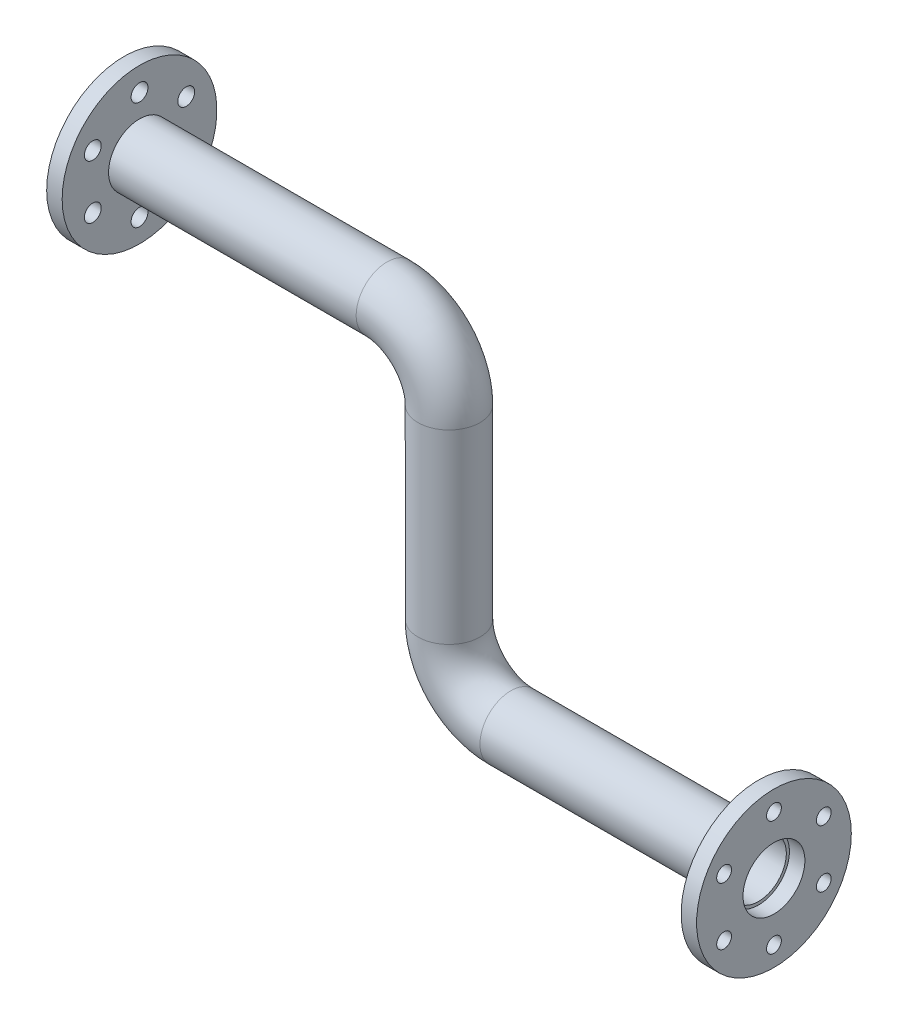
from build123d import *

# Parameters (mm, degrees)
SWEEP1_PROFILE_R     = 10
CUT_SWEEP1_PROFILE_R = 9
SKETCH23_R           = 25
SKETCH23_R_2         = 10
BOSS_EXTRUDE2_DEPTH  = 5
SKETCH24_R           = 2.725046036
CUT_EXTRUDE2_DEPTH   = 5
CIRPATTERN1_COUNT    = 6
SKETCH27_R           = 25
SKETCH27_R_2         = 10
BOSS_EXTRUDE3_DEPTH  = 5
SKETCH28_R           = 2.394091988
CUT_EXTRUDE3_DEPTH   = 5
CIRPATTERN2_COUNT    = 6


with BuildPart() as part:
    # Sweep1: sweep along a path in Sketch1
    with BuildLine(Plane.XY) as sweep1_path:
        Line((0, 0), (80, 0))
        ThreePointArc((80, 0), (94.142135624, -5.857864376), (100, -20))
        Line((100, -20), (100, -80))
        ThreePointArc((100, -80), (105.857864376, -94.142135624), (120, -100))
        Line((120, -100), (200, -100))
    # Sweep1 profile (on start of the path) → Sweep1 (sweep)
    with BuildSketch(Plane(origin=(0, 0, 0), x_dir=(0, 0, 1), z_dir=(1, 0, 0))):
        Circle(SWEEP1_PROFILE_R)
    sweep(path=sweep1_path.line)

    # Cut-Sweep1: sweep along a path in Sketch1<3>
    with BuildLine(Plane.XY) as cut_sweep1_path:
        Line((0, 0), (80, 0))
        ThreePointArc((80, 0), (94.142135624, -5.857864376), (100, -20))
        Line((100, -20), (100, -80))
        ThreePointArc((100, -80), (105.857864376, -94.142135624), (120, -100))
        Line((120, -100), (200, -100))
    # Cut-Sweep1 profile (on start of the path) → Cut-Sweep1 (sweep, cut)
    with BuildSketch(Plane(origin=(0, 0, 0), x_dir=(0, 0, 1), z_dir=(1, 0, 0))):
        Circle(CUT_SWEEP1_PROFILE_R)
    sweep(path=cut_sweep1_path.line, mode=Mode.SUBTRACT)


with BuildPart() as body_2:
    # Sketch23 → Boss-Extrude2 (new body)
    with BuildSketch(Plane.ZY):
        Circle(SKETCH23_R)
        Circle(SKETCH23_R_2, mode=Mode.SUBTRACT)
    extrude(amount=BOSS_EXTRUDE2_DEPTH)

    # Sketch24 → Cut-Extrude2 (cut)
    with BuildSketch(Plane.ZY.offset(5)):
        with Locations((0, 17.42206534)):
            Circle(SKETCH24_R)
    cut_extrude2 = extrude(amount=-CUT_EXTRUDE2_DEPTH, mode=Mode.SUBTRACT)

    # CirPattern1: Cut-Extrude2 ×6 about axis
    cirpattern1_axis = Axis((0, 0, 0), (1, 0, 0))
    for i in range(1, CIRPATTERN1_COUNT):
        add(cut_extrude2.rotate(cirpattern1_axis, i * 360 / CIRPATTERN1_COUNT), mode=Mode.SUBTRACT)


with BuildPart() as body_3:
    # Sketch27 → Boss-Extrude3 (new body)
    with BuildSketch(Plane(origin=(200, 0, 0), x_dir=(0, 0, -1), z_dir=(1, 0, 0))):
        with Locations((0, -100)):
            Circle(SKETCH27_R)
        with Locations((0, -100)):
            Circle(SKETCH27_R_2, mode=Mode.SUBTRACT)
    extrude(amount=BOSS_EXTRUDE3_DEPTH)

    # Sketch28 → Cut-Extrude3 (cut)
    with BuildSketch(Plane(origin=(205, 0, 0), x_dir=(0, 0, -1), z_dir=(1, 0, 0))):
        with Locations((0, -81.403185967)):
            Circle(SKETCH28_R)
    cut_extrude3 = extrude(amount=-CUT_EXTRUDE3_DEPTH, mode=Mode.SUBTRACT)

    # CirPattern2: Cut-Extrude3 ×6 about axis
    cirpattern2_axis = Axis((0, -100, 0), (1, 0, 0))
    for i in range(1, CIRPATTERN2_COUNT):
        add(cut_extrude3.rotate(cirpattern2_axis, i * 360 / CIRPATTERN2_COUNT), mode=Mode.SUBTRACT)


solid = Compound([part.part, body_2.part, body_3.part])
